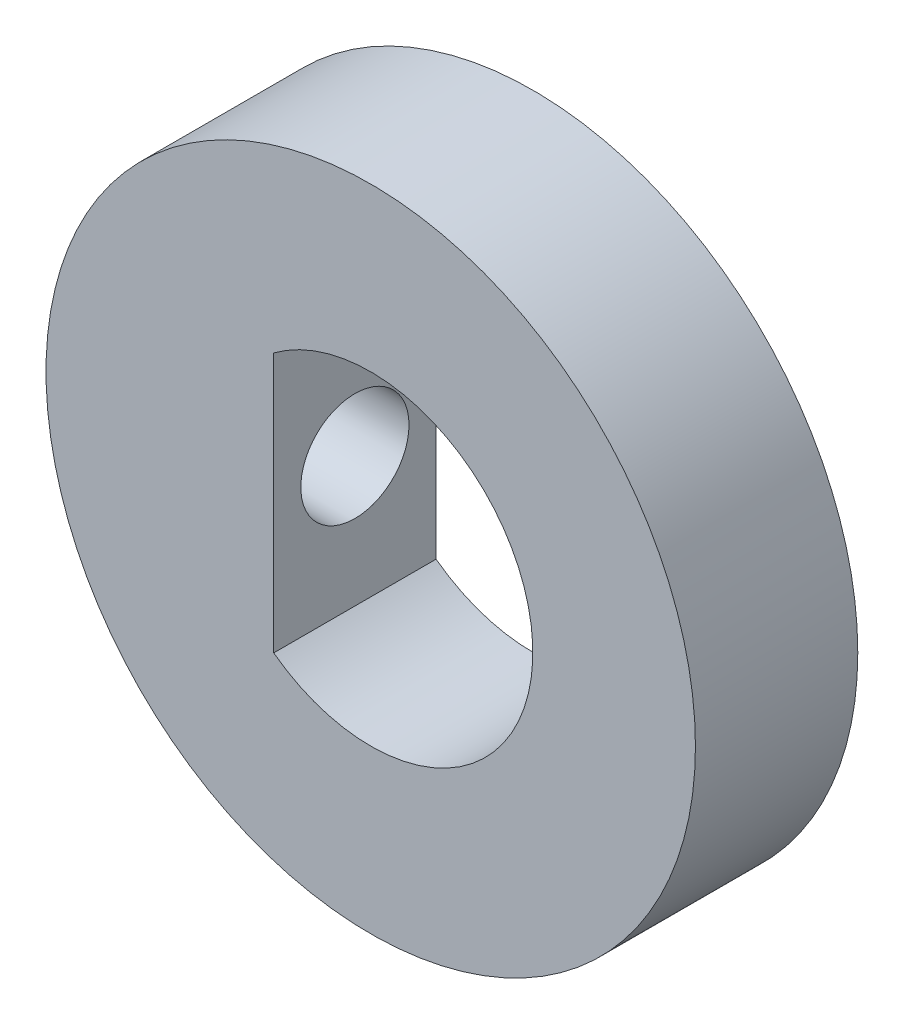
from build123d import *

# Parameters (mm, degrees)
ESQUISSE1_R             = 6
BOSS_EXTRU_1_DEPTH      = 3
ESQUISSE3_R             = 1
ENL_V_MAT_EXTRU_1_DEPTH = 10


with BuildPart() as part:
    # Esquisse1 → Boss.-Extru.1 (new body)
    with BuildSketch(Plane.XY):
        Circle(ESQUISSE1_R)
        with BuildLine():
            Line((-1.792296291, -2.4), (-1.792296291, 2.4))
            ThreePointArc((-1.792296291, 2.4), (2.995384115, 0), (-1.792296291, -2.4))
        make_face(mode=Mode.SUBTRACT)
    extrude(amount=BOSS_EXTRU_1_DEPTH)

    # Esquisse3 → Enlèv. mat.-Extru.1 (cut)
    with BuildSketch(Plane(origin=(-1.792296291, 0, 0), x_dir=(0, 0, -1), z_dir=(1, 0, 0))):
        with Locations((-1.5, 0)):
            Circle(ESQUISSE3_R)
    extrude(amount=-ENL_V_MAT_EXTRU_1_DEPTH, mode=Mode.SUBTRACT)


solid = part.part
